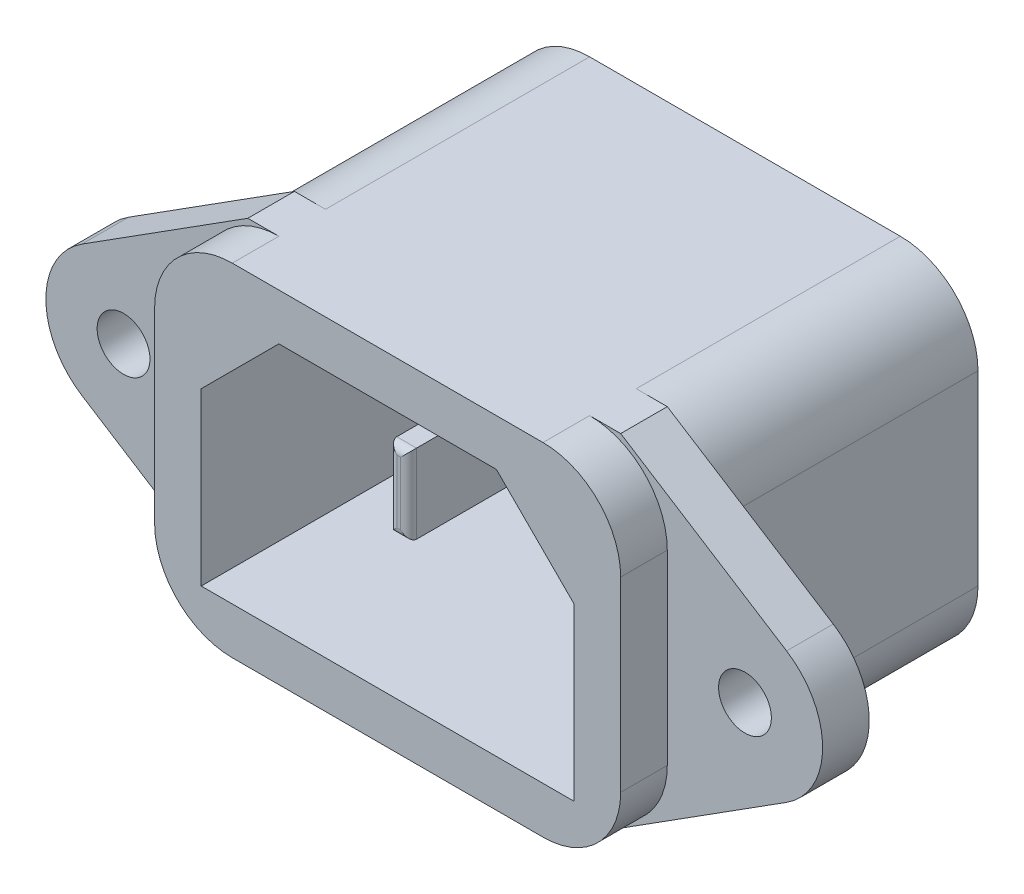
from build123d import *

# Parameters (mm, degrees)
BOSS_EXTRUDE1_DEPTH      = 3
SKETCH2_R                = 1.7
CUT_EXTRUDE1_DEPTH       = 3
BOSS_EXTRUDE2_DEPTH      = 3
BOSS_EXTRUDE2_DEPTH_BACK = 20
CUT_EXTRUDE2_DEPTH       = 17
SKETCH6_W                = 1.27
SKETCH6_H                = 5.08
BOSS_EXTRUDE3_DEPTH      = 10
FILLET1_R                = 0.508


with BuildPart() as part:
    # Sketch1 → Boss-Extrude1 (new body)
    with BuildSketch(Plane.XY):
        with BuildLine():
            Line((24, 22), (34.679465326, 15.221429328))
            ThreePointArc((34.679465326, 15.221429328), (37, 11), (34.679465326, 6.778570672))
            Line((34.679465326, 6.778570672), (24, 0))
            Line((24, 0), (0, 0))
            Line((0, 0), (-10.679465326, 6.778570672))
            ThreePointArc((-10.679465326, 6.778570672), (-13, 11), (-10.679465326, 15.221429328))
            Line((-10.679465326, 15.221429328), (0, 22))
            Line((0, 22), (24, 22))
        make_face()
    extrude(amount=BOSS_EXTRUDE1_DEPTH)

    # Sketch2 → Cut-Extrude1 (cut)
    with BuildSketch(Plane.XY.offset(3)):
        with Locations((32, 11)):
            Circle(SKETCH2_R)
        with Locations((-8, 11)):
            Circle(SKETCH2_R)
    extrude(amount=-CUT_EXTRUDE1_DEPTH, mode=Mode.SUBTRACT)

    # Sketch3 → Boss-Extrude2 (add, two sides: drawn at the far end of the back side and taken through both)
    with BuildSketch(Plane.XY.offset(3).offset(-BOSS_EXTRUDE2_DEPTH_BACK)):
        with BuildLine():
            Line((2, 22), (22, 22))
            ThreePointArc((22, 22), (25.535533906, 20.535533906), (27, 17))
            Line((27, 17), (27, 5))
            ThreePointArc((27, 5), (25.535533906, 1.464466094), (22, 0))
            Line((22, 0), (2, 0))
            ThreePointArc((2, 0), (-1.535533906, 1.464466094), (-3, 5))
            Line((-3, 5), (-3, 17))
            ThreePointArc((-3, 17), (-1.535533906, 20.535533906), (2, 22))
        make_face()
    extrude(amount=BOSS_EXTRUDE2_DEPTH + BOSS_EXTRUDE2_DEPTH_BACK)

    # Sketch5 → Cut-Extrude2 (cut)
    with BuildSketch(Plane.XY.offset(6)):
        Polygon((5, 19), (19, 19), (24, 14), (24, 3), (0, 3), (0, 14), align=None)
    extrude(amount=-CUT_EXTRUDE2_DEPTH, mode=Mode.SUBTRACT)

    # Sketch6 → Boss-Extrude3 (add)
    with BuildSketch(Plane.XY.offset(-11)):
        with Locations((12.058361068, 15.19)):
            Rectangle(SKETCH6_W, SKETCH6_H)
        with Locations((18.285, 7.57)):
            Rectangle(SKETCH6_W, SKETCH6_H)
        with Locations((5.715, 7.57)):
            Rectangle(SKETCH6_W, SKETCH6_H)
    extrude(amount=BOSS_EXTRUDE3_DEPTH)

    # Fillet1
    fillet1_edges = [part.edges().sort_by_distance(p)[0] for p in [
        (18.92, 7.57, -1),
        (18.285, 10.11, -1),
        (17.65, 7.57, -1),
        (18.285, 5.03, -1),
        (6.35, 7.57, -1),
        (5.715, 10.11, -1),
        (5.08, 7.57, -1),
        (5.715, 5.03, -1),
        (12.693361068, 15.19, -1),
        (12.058361068, 17.73, -1),
        (11.423361068, 15.19, -1),
        (12.058361068, 12.65, -1),
    ]]
    fillet(fillet1_edges, radius=FILLET1_R)


solid = part.part
